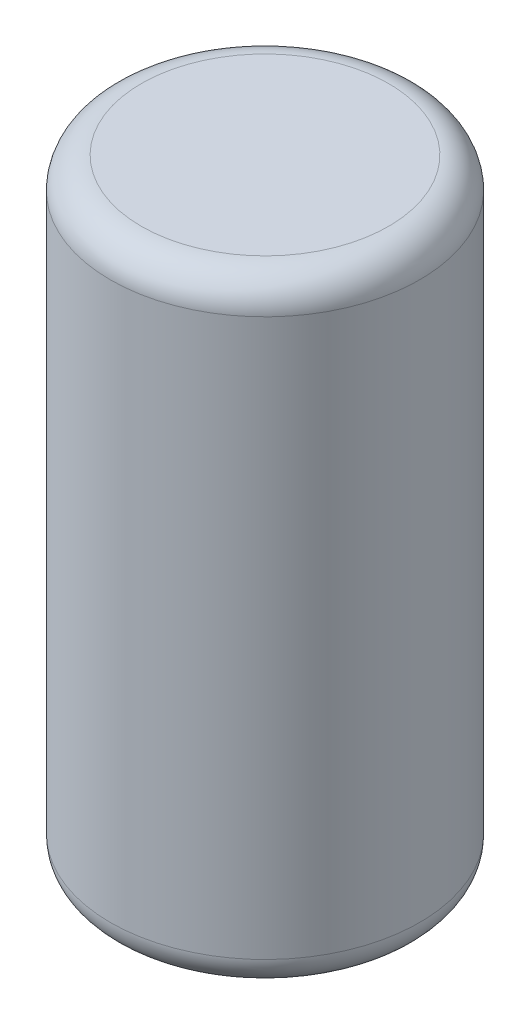
from build123d import *

# Parameters (mm, degrees)
SKETCH1_R           = 3.175
BOSS_EXTRUDE1_DEPTH = 12.7
FILLET1_R           = 0.635


with BuildPart() as part:
    # Sketch1 → Boss-Extrude1 (new body)
    with BuildSketch(Plane(origin=(0, 0, 0), x_dir=(1, 0, 0), z_dir=(0, 1, 0))):
        with Locations(Location((0, 0, 0), (0, 0, 270))):
            Circle(SKETCH1_R)
    extrude(amount=BOSS_EXTRUDE1_DEPTH)

    # Fillet1
    fillet1_edges = [part.edges().sort_by_distance(p)[0] for p in [
        (0, 0, -3.175),
        (0, 12.7, -3.175),
    ]]
    fillet(fillet1_edges, radius=FILLET1_R)


solid = part.part
